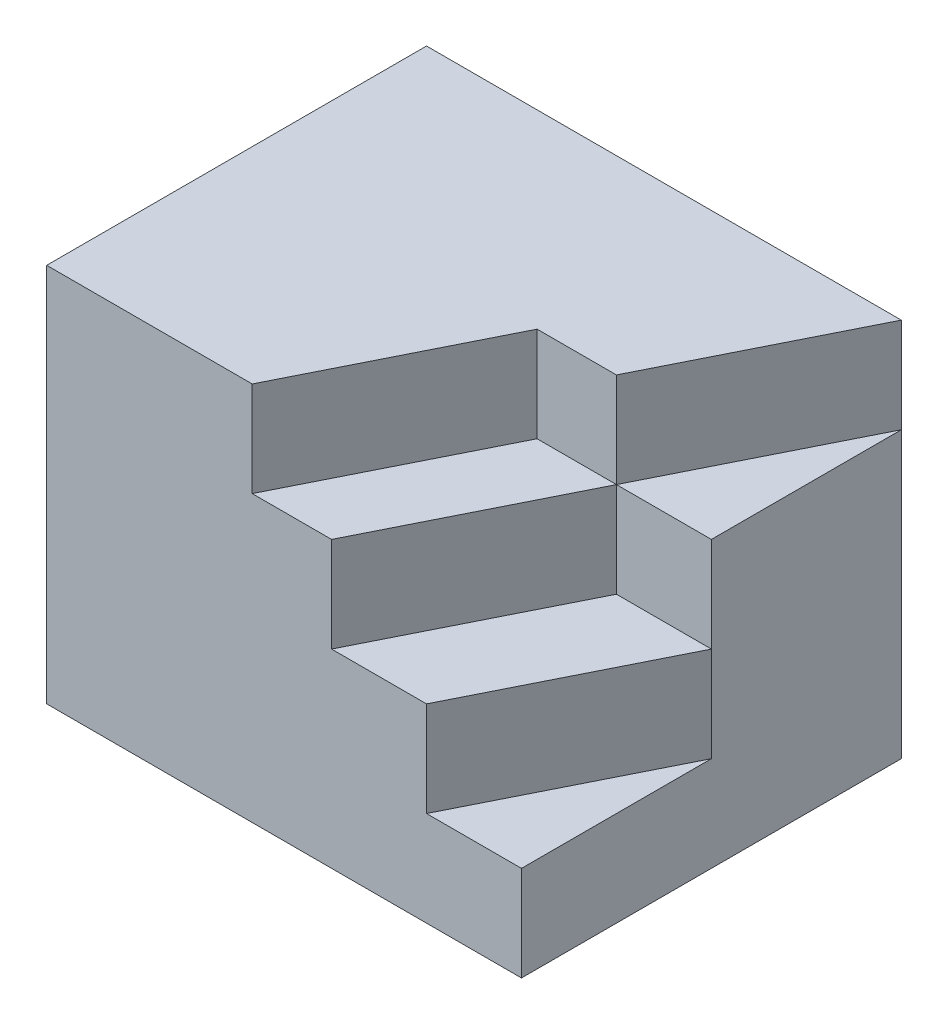
from build123d import *

# Parameters (mm, degrees)
SKETCH1_W           = 50
SKETCH1_H           = 40
BOSS_EXTRUDE1_DEPTH = 40
CUT_EXTRUDE1_DEPTH  = 30
CUT_EXTRUDE2_DEPTH  = 20
CUT_EXTRUDE3_DEPTH  = 10
CUT_EXTRUDE4_DEPTH  = 10


with BuildPart() as part:
    # Sketch1 → Boss-Extrude1 (new body)
    with BuildSketch(Plane(origin=(0, 0, 0), x_dir=(1, 0, 0), z_dir=(0, 1, 0))):
        Rectangle(SKETCH1_W, SKETCH1_H)
    extrude(amount=BOSS_EXTRUDE1_DEPTH)

    # Sketch2 → Cut-Extrude1 (cut)
    with BuildSketch(Plane(origin=(0, 40, 0), x_dir=(1, 0, 0), z_dir=(0, 1, 0))):
        Polygon((25, 0), (15, -20), (25, -20), align=None)
    extrude(amount=-CUT_EXTRUDE1_DEPTH, mode=Mode.SUBTRACT)

    # Sketch3 → Cut-Extrude2 (cut)
    with BuildSketch(Plane(origin=(0, 40, 0), x_dir=(1, 0, 0), z_dir=(0, 1, 0))):
        Polygon((15, 0), (5, -20), (15, -20), (25, 0), align=None)
    extrude(amount=-CUT_EXTRUDE2_DEPTH, mode=Mode.SUBTRACT)

    # Sketch4 → Cut-Extrude3 (cut)
    with BuildSketch(Plane(origin=(0, 40, 0), x_dir=(1, 0, 0), z_dir=(0, 1, 0))):
        Polygon((25, 20), (15, 0), (25, 0), align=None)
    extrude(amount=-CUT_EXTRUDE3_DEPTH, mode=Mode.SUBTRACT)

    # Sketch5 → Cut-Extrude4 (cut)
    with BuildSketch(Plane(origin=(0, 40, 0), x_dir=(1, 0, 0), z_dir=(0, 1, 0))):
        Polygon((15, 0), (6.643581927, 0), (-3.356418073, -20), (5, -20), align=None)
    extrude(amount=-CUT_EXTRUDE4_DEPTH, mode=Mode.SUBTRACT)


solid = part.part
